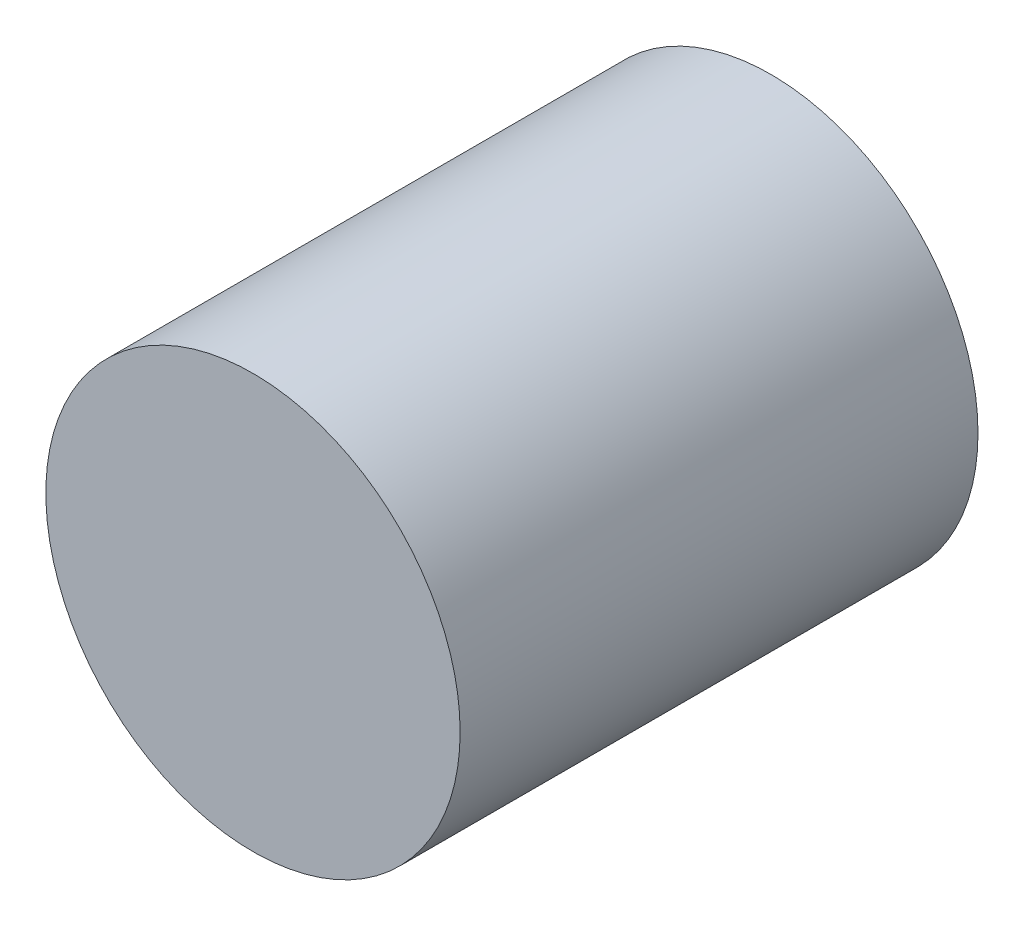
from build123d import *

# Parameters (mm, degrees)
SKETCH1_R           = 50
BOSS_EXTRUDE1_DEPTH = 125


with BuildPart() as part:
    # Sketch1 → Boss-Extrude1 (new body)
    with BuildSketch(Plane.XY):
        Circle(SKETCH1_R)
    extrude(amount=-BOSS_EXTRUDE1_DEPTH)

    # Sketch2 → Cut-Revolve1 (revolve, cut)
    with BuildSketch(Plane(origin=(0, 0, 0), x_dir=(0, 0, -1), z_dir=(1, 0, 0))):
        with BuildLine():
            Line((125, 0), (5.998963746, 0))
            add(Edge.make_bspline(
                [(5.998963746, 0), (42.884962987, 49.299187879), (73.943461013, 41.969471568), (125, 45.892435664)],
                knots=[0, 0, 0, 0, 1, 1, 1, 1], degree=3))
            Line((125, 45.892435664), (125, 0))
        make_face()
    revolve(axis=Axis((0, 0, -125), (0, 0, 1)), mode=Mode.SUBTRACT)


solid = part.part
